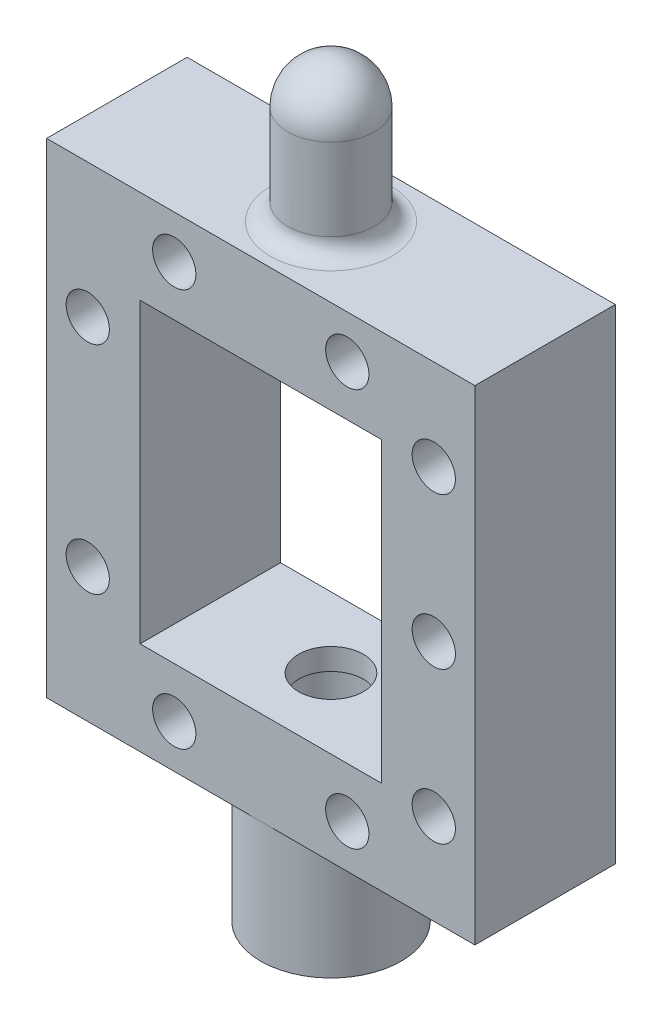
from build123d import *

# Parameters (mm, degrees)
SKETCH1_W                   = 62.865
SKETCH1_H                   = 71.12
BOSS_EXTRUDE1_DEPTH         = 20.6248
CUT_EXTRUDE2_DEPTH          = 52.748410906
CUT_EXTRUDE2_DEPTH_BACK     = 52.748410906
SKETCH4_R                   = 3.175
FILLET1_R                   = 2.54
SKETCH2_W                   = 35.433
SKETCH2_H                   = 43.688
CUT_EXTRUDE3_DEPTH          = 68.839744016
SKETCH6_R                   = 2.7686
CUT_EXTRUDE4_DEPTH          = 27.94
SKETCH7_R                   = 10.3124
BOSS_EXTRUDE2_DEPTH         = 17.78
CUT_EXTRUDE5_START          = -17.78
CUT_EXTRUDE5_DEPTH          = 17.78
SKETCH9_R                   = 4.7625
CUT_EXTRUDE6_DEPTH          = 3.175
F_1_2_20_TAPPED_HOLE1_D     = 11.50874
F_1_2_20_TAPPED_HOLE1_DEPTH = 28.321


with BuildPart() as part:
    # Sketch1 → Boss-Extrude1 (new body)
    with BuildSketch(Plane.XY):
        Rectangle(SKETCH1_W, SKETCH1_H)
    extrude(amount=BOSS_EXTRUDE1_DEPTH)

    # Sketch4 → Cut-Extrude2 (cut, two sides: drawn at the far end of the back side and taken through both)
    with BuildSketch(Plane.XY.offset(20.6248).offset(-CUT_EXTRUDE2_DEPTH_BACK)):
        with Locations((-12.7, 29.21)):
            Circle(SKETCH4_R)
        with Locations((-25.4, 15.875)):
            Circle(SKETCH4_R)
        with Locations((-12.7, -29.21)):
            Circle(SKETCH4_R)
        with Locations((-25.4, -15.875)):
            Circle(SKETCH4_R)
        with Locations((12.7, -29.21)):
            Circle(SKETCH4_R)
        with Locations((12.7, 29.21)):
            Circle(SKETCH4_R)
        with Locations((25.4, 0)):
            Circle(SKETCH4_R)
        with Locations((25.4, 22.225)):
            Circle(SKETCH4_R)
        with Locations((25.4, -22.225)):
            Circle(SKETCH4_R)
    extrude(amount=CUT_EXTRUDE2_DEPTH + CUT_EXTRUDE2_DEPTH_BACK, mode=Mode.SUBTRACT)

    # Sketch5 → Revolve2 (revolve)
    with BuildSketch(Plane(origin=(0, 0, 0), x_dir=(0, 0, -1), z_dir=(1, 0, 0)), mode=Mode.PRIVATE) as revolve2_sk:
        with BuildLine():
            Line((-16.6624, 35.56), (-16.6624, 50.119871939))
            ThreePointArc((-16.6624, 50.119871939), (-14.802528061, 54.61), (-10.3124, 56.469871939))
            Line((-10.3124, 56.469871939), (-10.3124, 35.56))
            Line((-10.3124, 35.56), (-16.6624, 35.56))
        make_face()
    revolve(revolve2_sk.sketch.rotate(Axis((0, 35.56, 10.3124), (0, 1, 0)), 180), axis=Axis((0, 35.56, 10.3124), (0, 1, 0)))

    # Fillet1
    fillet1_edges = [part.edges().sort_by_distance(p)[0] for p in [
        (0, 35.56, 16.6624),
    ]]
    fillet(fillet1_edges, radius=FILLET1_R)

    # Sketch2 → Cut-Extrude3 (cut, through all)
    with BuildSketch(Plane.XY.offset(20.6248)):
        Rectangle(SKETCH2_W, SKETCH2_H)
    extrude(amount=-CUT_EXTRUDE3_DEPTH, mode=Mode.SUBTRACT)

    # Sketch6 → Cut-Extrude4 (cut)
    with BuildSketch(Plane.XZ.offset(-21.844)):
        with Locations(Location((0, 10.3124, 0), (0, 0, 270))):
            Circle(SKETCH6_R)
    extrude(amount=-CUT_EXTRUDE4_DEPTH, mode=Mode.SUBTRACT)

    # Sketch7 → Boss-Extrude2 (add)
    with BuildSketch(Plane.XZ.offset(35.56)):
        with Locations(Location((0, 10.3124, 0), (0, 0, 270))):
            Circle(SKETCH7_R)
    extrude(amount=BOSS_EXTRUDE2_DEPTH)

    # Sketch8 → Cut-Extrude5 (cut)
    with BuildSketch(Plane.XZ.offset(53.34).offset(CUT_EXTRUDE5_START)):
        with BuildLine():
            Line((-7.399596954, 3.12967359), (-5.795378061, 3.12967359))
            Line((-5.795378061, 3.12967359), (7.399596954, 3.12967359))
            ThreePointArc((7.399596954, 3.12967359), (0, 0), (-7.399596954, 3.12967359))
        make_face()
    extrude(amount=CUT_EXTRUDE5_DEPTH, mode=Mode.SUBTRACT)

    # Sketch9 → Cut-Extrude6 (cut)
    with BuildSketch(Plane(origin=(0, -21.844, 0), x_dir=(1, 0, 0), z_dir=(0, 1, 0))):
        with Locations(Location((0, -10.3124, 0), (0, 0, 270))):
            Circle(SKETCH9_R)
    extrude(amount=-CUT_EXTRUDE6_DEPTH, mode=Mode.SUBTRACT)

    # 1/2-20 Tapped Hole1
    with Locations(Plane(origin=(0, -53.34, 0), x_dir=(-1, 0, 0), z_dir=(0, -1, 0))):
        with Locations((0, -10.3124)):
            Hole(F_1_2_20_TAPPED_HOLE1_D / 2, depth=F_1_2_20_TAPPED_HOLE1_DEPTH)


solid = part.part
